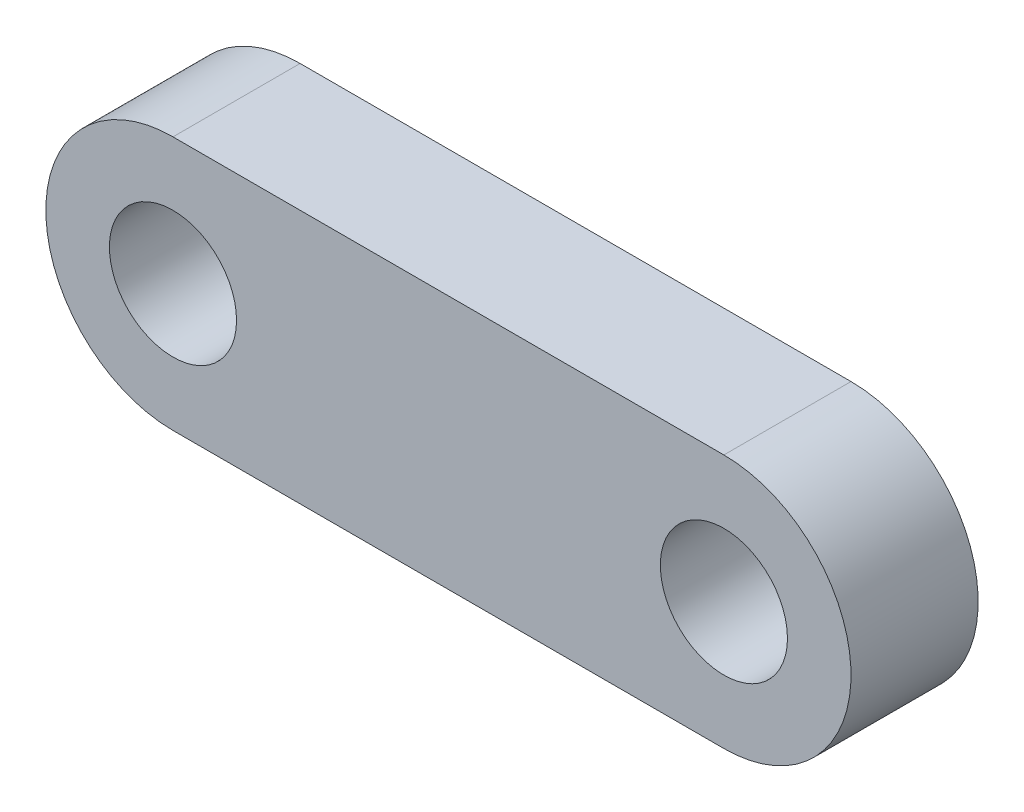
from build123d import *

# Parameters (mm, degrees)
SKETCH_1_R      = 1.5
EXTRUDE_1_DEPTH = 1.5


with BuildPart() as part:
    # 草图1 → 凸台-拉伸1 (new, symmetric)
    with BuildSketch(Plane.XY):
        with BuildLine():
            Line((0, -3), (-13, -3))
            ThreePointArc((-13, -3), (-16, 0), (-13, 3))
            Line((-13, 3), (0, 3))
            ThreePointArc((0, 3), (3, 0), (0, -3))
        make_face()
        with Locations((-13, 0)):
            Circle(SKETCH_1_R, mode=Mode.SUBTRACT)
        Circle(SKETCH_1_R, mode=Mode.SUBTRACT)
    extrude(amount=EXTRUDE_1_DEPTH, both=True)


solid = part.part
